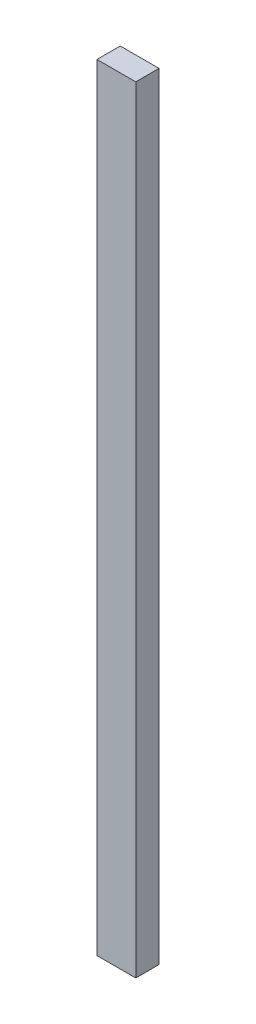
from build123d import *

# Parameters (mm, degrees)
SKETCH_1_W      = 5
SKETCH_1_H      = 3
EXTRUDE_1_DEPTH = 100


with BuildPart() as part:
    # 草图1 → 凸台-拉伸1 (new body)
    with BuildSketch(Plane(origin=(0, 0, 0), x_dir=(1, 0, 0), z_dir=(0, 1, 0))):
        Rectangle(SKETCH_1_W, SKETCH_1_H)
    extrude(amount=EXTRUDE_1_DEPTH)


solid = part.part
